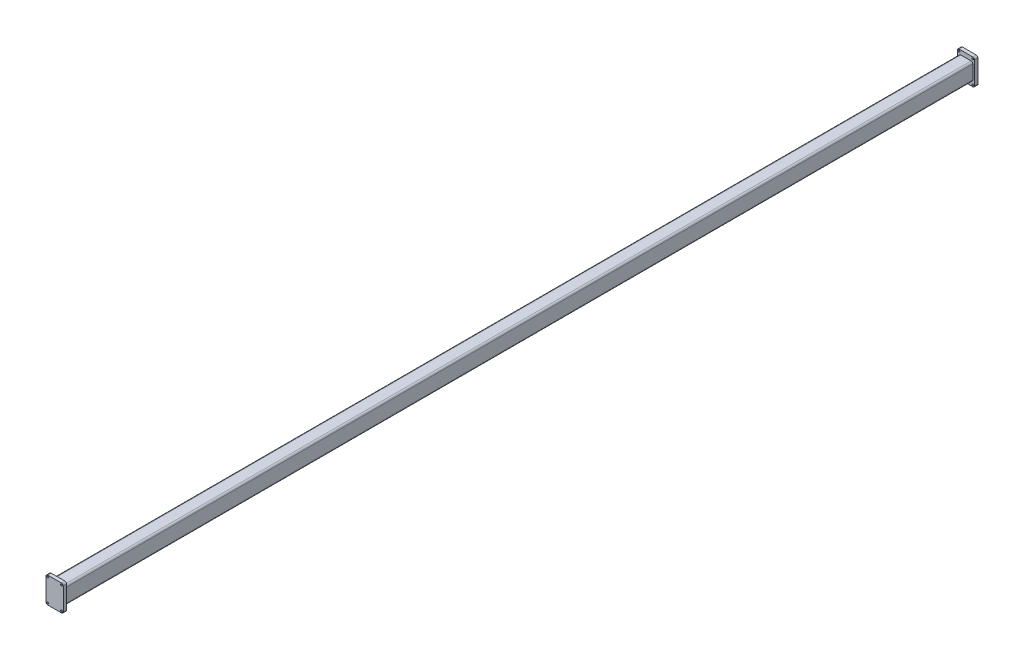
from build123d import *

# Parameters (mm, degrees)
SKETCH_1_R        = 0.5
EXTRUDE_1_DEPTH   = 2
SKETCH_2_W        = 6
SKETCH_2_H        = 8
EXTRUDE_1_2_DEPTH = 263
SCALE_1_SCALE     = 2
SCALE_2_SCALE     = 1.7


with BuildPart() as part:
    # 草图1 → Extrude 1 (new body)
    with BuildSketch(Plane.XY):
        with BuildLine():
            Line((-4, 7.5), (4, 7.5))
            ThreePointArc((4, 7.5), (4.707106781, 7.207106781), (5, 6.5))
            Line((5, 6.5), (5, -6.5))
            ThreePointArc((5, -6.5), (4.707106781, -7.207106781), (4, -7.5))
            Line((4, -7.5), (-4, -7.5))
            ThreePointArc((-4, -7.5), (-4.707106781, -7.207106781), (-5, -6.5))
            Line((-5, -6.5), (-5, 6.5))
            ThreePointArc((-5, 6.5), (-4.707106781, 7.207106781), (-4, 7.5))
        make_face()
        with Locations((4, 6.5)):
            Circle(SKETCH_1_R, mode=Mode.SUBTRACT)
        with Locations((-4, 6.5)):
            Circle(SKETCH_1_R, mode=Mode.SUBTRACT)
        with Locations((4, -6.5)):
            Circle(SKETCH_1_R, mode=Mode.SUBTRACT)
        with Locations((-4, -6.5)):
            Circle(SKETCH_1_R, mode=Mode.SUBTRACT)
    extrude(amount=EXTRUDE_1_DEPTH)

    # 草图2 → Extrude 1 2 (add)
    with BuildSketch(Plane(origin=(0, 0, 0), x_dir=(-1, 0, 0), z_dir=(0, 0, -1))):
        with BuildLine():
            Line((-3, 5), (3, 5))
            ThreePointArc((3, 5), (3.707106781, 4.707106781), (4, 4))
            Line((4, 4), (4, -4))
            ThreePointArc((4, -4), (3.707106781, -4.707106781), (3, -5))
            Line((3, -5), (-3, -5))
            ThreePointArc((-3, -5), (-3.707106781, -4.707106781), (-4, -4))
            Line((-4, -4), (-4, 4))
            ThreePointArc((-4, 4), (-3.707106781, 4.707106781), (-3, 5))
        make_face()
        Rectangle(SKETCH_2_W, SKETCH_2_H, mode=Mode.SUBTRACT)
    extrude(amount=EXTRUDE_1_2_DEPTH)

    # 镜向1: part across plane


with BuildPart() as part_1:
    add(part.part)
    add(part.part.mirror(Plane(origin=(3, -4, -263), x_dir=(1, 0, 0), z_dir=(0, 0, -1))))


with BuildPart() as part_2:
    # 缩放比例1: scaled about (0, 0, 0)
    add(part_1.part.scale(SCALE_1_SCALE))


with BuildPart() as part_3:
    # 缩放比例2: scaled about (0, 0, 0)
    add(part_2.part.scale(SCALE_2_SCALE))


solid = part_3.part
